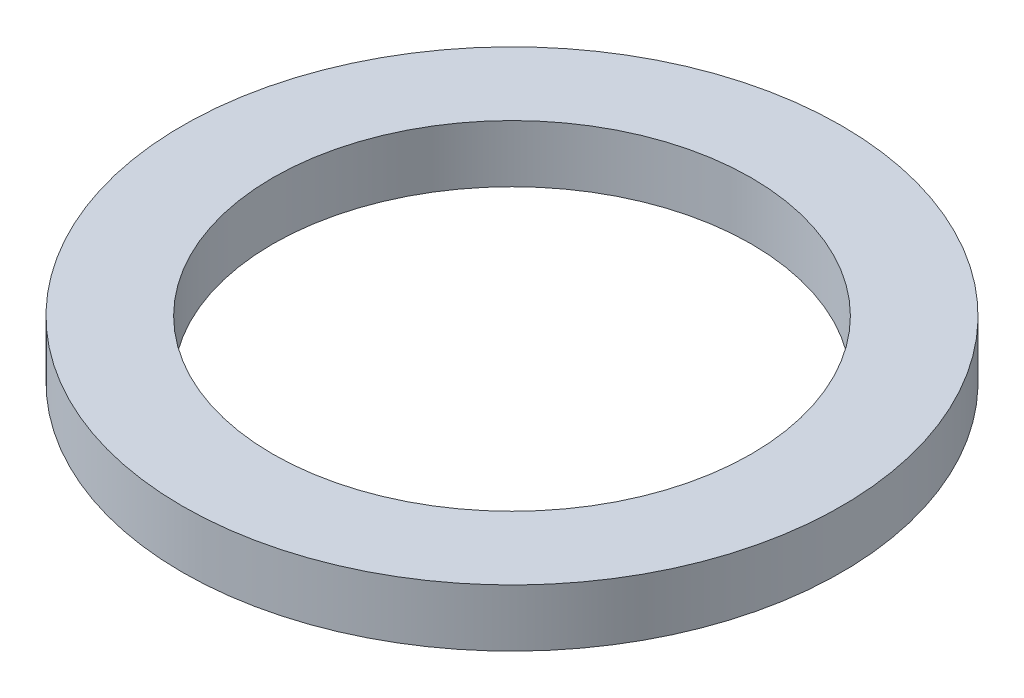
from build123d import *

# Parameters (mm, degrees)
SKETCH_1_R      = 23
SKETCH_1_R_2    = 16.7
EXTRUDE_1_DEPTH = 4


with BuildPart() as part:
    # Эскиз1 → Бобышка-Вытянуть1 (new body)
    with BuildSketch(Plane(origin=(0, 0, 0), x_dir=(1, 0, 0), z_dir=(0, 1, 0))):
        with Locations(Location((0, 0, 0), (0, 0, 270))):
            Circle(SKETCH_1_R)
        with Locations(Location((0, 0, 0), (0, 0, 270))):
            Circle(SKETCH_1_R_2, mode=Mode.SUBTRACT)
    extrude(amount=EXTRUDE_1_DEPTH)


solid = part.part
